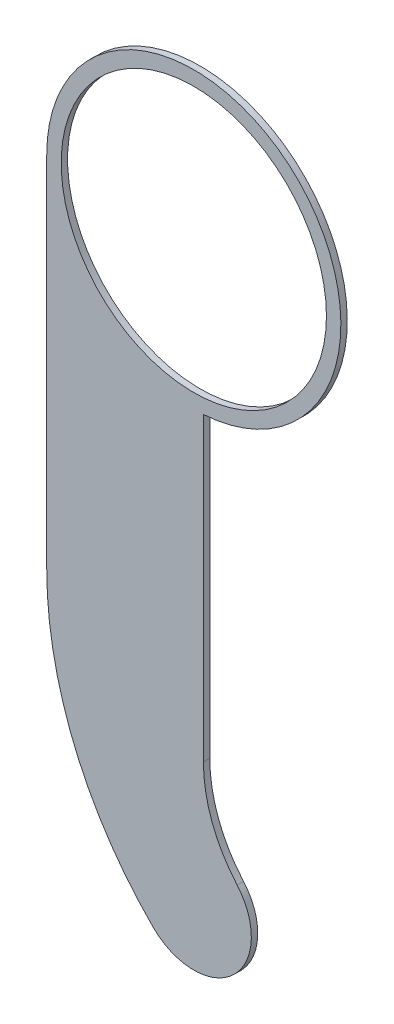
from build123d import *

# Parameters (mm, degrees)
SKETCH_1_R      = 41.5
EXTRUDE_1_DEPTH = 2


with BuildPart() as part:
    # 草图1 → 凸台-拉伸1 (new body)
    with BuildSketch(Plane.XY):
        with BuildLine():
            Line((3, -140.066053532), (3, -45.918827896))
            ThreePointArc((3, -45.918827896), (31.460201745, 33.582651198), (-46.016722562, 0))
            Line((-46.016722562, 0), (-46.016722562, -112.361648418))
            ThreePointArc((-46.016722562, -112.361648418), (-37.365245186, -155.855562297), (-12.727922061, -192.727922061))
            ThreePointArc((-12.727922061, -192.727922061), (12.295990665, -193.145669004), (13.548765941, -168.149643825))
            ThreePointArc((13.548765941, -168.149643825), (5.724176996, -155.065757751), (3, -140.066053532))
        make_face()
        Circle(SKETCH_1_R, mode=Mode.SUBTRACT)
    extrude(amount=EXTRUDE_1_DEPTH)


solid = part.part
